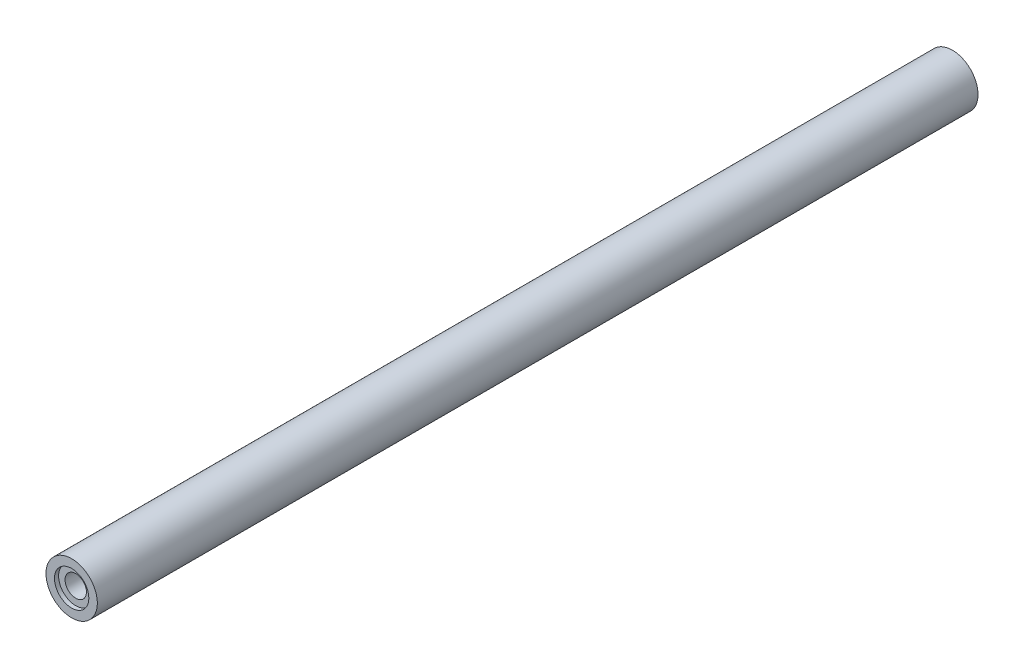
from build123d import *

# Parameters (mm, degrees)
SKETCH1_R                   = 9.525
BOSS_EXTRUDE1_DEPTH         = 327.025
SKETCH2_R                   = 6.3754
CUT_EXTRUDE1_DEPTH          = 1.524
F_3_8_16_TAPPED_HOLE1_D     = 7.9375
F_3_8_16_TAPPED_HOLE1_DEPTH = 25.4
F_3_8_16_TAPPED_HOLE1_TIP   = 2.384665582
CUT_EXTRUDE2_START          = -1.524
SKETCH5_R                   = 6.3754
CUT_EXTRUDE2_DEPTH          = 1.524
F_3_8_16_TAPPED_HOLE2_D     = 7.9375
F_3_8_16_TAPPED_HOLE2_DEPTH = 25.4
F_3_8_16_TAPPED_HOLE2_TIP   = 2.384665582


with BuildPart() as part:
    # Sketch1 → Boss-Extrude1 (new body)
    with BuildSketch(Plane.XY):
        with Locations(Location((0, 0, 0), (0, 0, 180))):
            Circle(SKETCH1_R)
    extrude(amount=BOSS_EXTRUDE1_DEPTH)

    # Sketch2 → Cut-Extrude1 (cut)
    with BuildSketch(Plane.XY.offset(327.025)):
        Circle(SKETCH2_R)
    extrude(amount=-CUT_EXTRUDE1_DEPTH, mode=Mode.SUBTRACT)

    # 3/8-16 Tapped Hole1
    with Locations(Plane.XY.offset(325.501)):
        with Locations((0, 0)):
            Hole(F_3_8_16_TAPPED_HOLE1_D / 2, depth=F_3_8_16_TAPPED_HOLE1_DEPTH)
            with Locations((0, 0, -(F_3_8_16_TAPPED_HOLE1_DEPTH + F_3_8_16_TAPPED_HOLE1_TIP / 2))):  # 118° drill point
                Cone(0, F_3_8_16_TAPPED_HOLE1_D / 2, F_3_8_16_TAPPED_HOLE1_TIP, mode=Mode.SUBTRACT)

    # Sketch5 → Cut-Extrude2 (cut)
    with BuildSketch(Plane(origin=(0, 0, 0), x_dir=(-1, 0, 0), z_dir=(0, 0, -1)).offset(CUT_EXTRUDE2_START)):
        with Locations(Location((0, 0, 0), (0, 0, 180))):
            Circle(SKETCH5_R)
    extrude(amount=CUT_EXTRUDE2_DEPTH, mode=Mode.SUBTRACT)

    # 3/8-16 Tapped Hole2
    with Locations(Plane(origin=(0, 0, 1.524), x_dir=(-1, 0, 0), z_dir=(0, 0, -1))):
        with Locations((0, 0)):
            Hole(F_3_8_16_TAPPED_HOLE2_D / 2, depth=F_3_8_16_TAPPED_HOLE2_DEPTH)
            with Locations((0, 0, -(F_3_8_16_TAPPED_HOLE2_DEPTH + F_3_8_16_TAPPED_HOLE2_TIP / 2))):  # 118° drill point
                Cone(0, F_3_8_16_TAPPED_HOLE2_D / 2, F_3_8_16_TAPPED_HOLE2_TIP, mode=Mode.SUBTRACT)


solid = part.part
